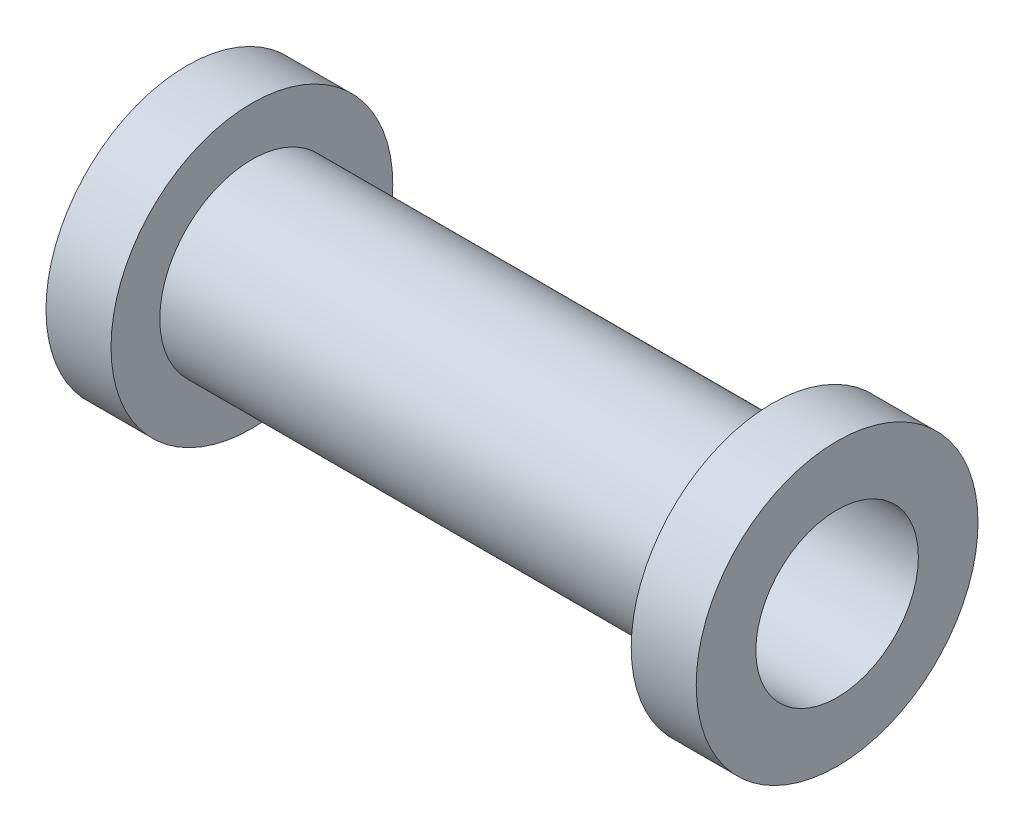
from build123d import *

# Parameters (mm, degrees)
SKETCH1_W = 30.48
SKETCH1_H = 1.27


with BuildPart() as part:
    # Sketch1 → Revolve2 (revolve)
    with BuildSketch(Plane.XY, mode=Mode.PRIVATE) as revolve2_sk:
        with Locations((15.24, 10.16)):
            Rectangle(SKETCH1_W, SKETCH1_H)
        with Locations((-15.24, 10.16)):
            Rectangle(SKETCH1_W, SKETCH1_H)
        Polygon((30.48, 10.795), (30.48, 9.525), (38.1, 9.525), (38.1, 16.51), (30.48, 16.51), align=None)
        Polygon((-38.1, 9.525), (-30.48, 9.525), (-30.48, 10.795), (-30.48, 16.51), (-38.1, 16.51), align=None)
    revolve(revolve2_sk.sketch.rotate(Axis((-30.48, 0, 0), (1, 0, 0)), 90), axis=Axis((-30.48, 0, 0), (1, 0, 0)))


solid = part.part
